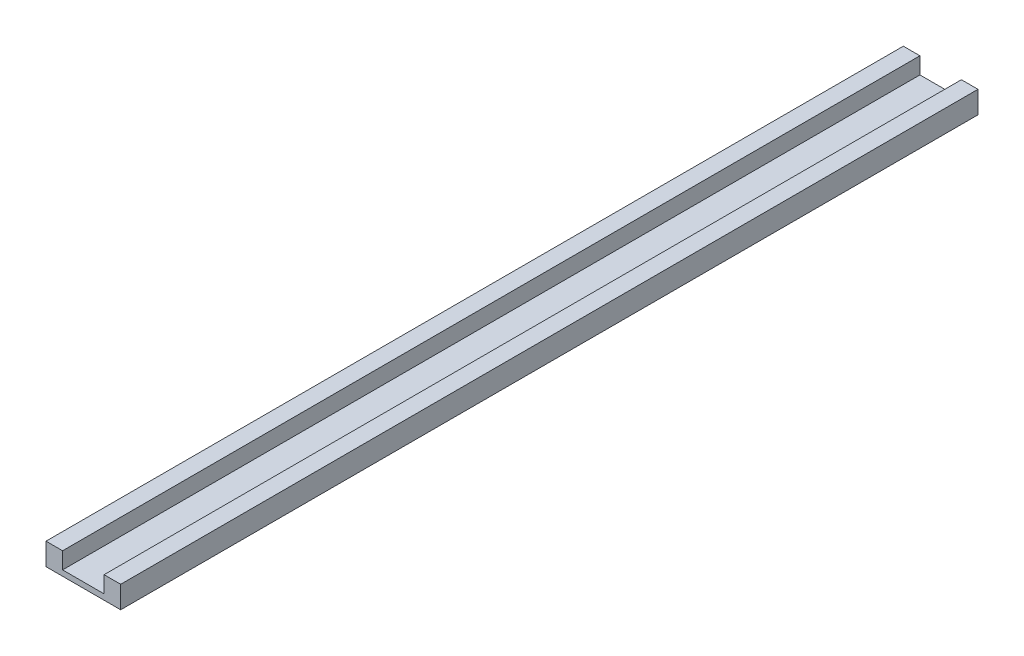
from build123d import *

# Parameters (mm, degrees)
BOSS_EXTRU_1_DEPTH = 350
CUT_EXTRUDE1_DEPTH = 40


with BuildPart() as part:
    # Esquisse1 → Boss.-Extru.1 (new body)
    with BuildSketch(Plane.XY):
        Polygon((-7.5, 4), (-13.5, 4), (-13.5, -4), (13.5, -4), (13.5, 4), (7.5, 4), (7.5, -2), (-7.5, -2), align=None)
    extrude(amount=BOSS_EXTRU_1_DEPTH)

    # Sketch1 → Cut-Extrude1 (cut)
    with BuildSketch(Plane(origin=(0, 0, 0), x_dir=(-1, 0, 0), z_dir=(0, 0, -1))):
        Polygon((-7.5, 4), (-13.5, 4), (-13.5, -4), (13.5, -4), (13.5, 4), (7.5, 4), (7.5, -2), (-7.5, -2), align=None)
    extrude(amount=-CUT_EXTRUDE1_DEPTH, mode=Mode.SUBTRACT)


solid = part.part
